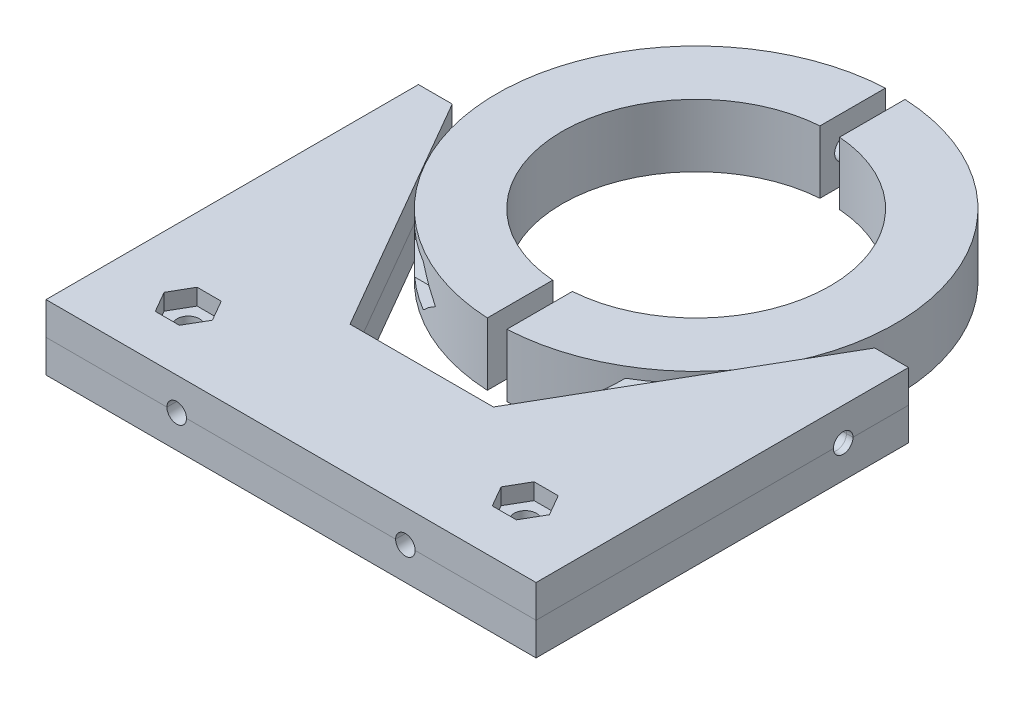
from build123d import *

# Parameters (mm, degrees)
SKETCH_3_W                       = 10
SKETCH_3_H                       = 9.6
CUT_EXTRUDE_1_DEPTH              = 44.399769585
CUT_EXTRUDE_1_DEPTH_BACK         = 44.399769585
SKETCH_5_W                       = 32
SKETCH_5_H                       = 100
HOLE_WIZARD_3_5_3_5_1_D          = 3.5
CUT_EXTRUDE_5_DEPTH              = 23
EXTRUDE_1_DEPTH                  = 5
SKETCH_14_R                      = 1.5
SKETCH_14_3_R                    = 1.5
HOLE_WIZARD_3_4_3_4_1_AT_2_COUNT = 2
HOLE_WIZARD_3_4_3_4_1_AT_2_PITCH = 51.570523521
CUT_EXTRUDE_4_DEPTH              = 2.5


with BuildPart() as part:
    # 掃出1: sweep along a path in 草圖2
    with BuildLine(Plane(origin=(0, 0, 0), x_dir=(1, 0, 0), z_dir=(0, 1, 0))) as sweep_1_path:
        CenterArc((0, 0), 20.5, 0, 360)
    # 草圖3 → 掃出1 (sweep)
    with BuildSketch(Plane(origin=(0, 0, 0), x_dir=(0, 0, -1), z_dir=(1, 0, 0))):
        with Locations((25.5, 0)):
            Rectangle(SKETCH_3_W, SKETCH_3_H)
    sweep(path=sweep_1_path.line)

    # 草圖5 → 除料-伸長1 (cut, two sides: drawn at the far end of the back side and taken through both)
    with BuildSketch(Plane(origin=(0, 0, 0), x_dir=(1, 0, 0), z_dir=(0, 1, 0)).offset(-CUT_EXTRUDE_1_DEPTH_BACK)):
        with Locations((-14.5, 0)):
            Rectangle(SKETCH_5_W, SKETCH_5_H)
    extrude(amount=CUT_EXTRUDE_1_DEPTH + CUT_EXTRUDE_1_DEPTH_BACK, mode=Mode.SUBTRACT)

    # Ø3.5 (3.5) 直徑孔1 (through all)
    with Locations(Plane(origin=(30.5, 0, 0), x_dir=(0, 0, -1), z_dir=(1, 0, 0))):
        with Locations((-24.4450483, 0), (24.4450483, 0)):
            Hole(HOLE_WIZARD_3_5_3_5_1_D / 2)

    # 草圖6 → 除料-伸長5 (cut)
    with BuildSketch(Plane(origin=(30.5, 0, 0), x_dir=(0, 0, -1), z_dir=(1, 0, 0))):
        Polygon((28.140090023, 0), (26.292569162, 3.2), (22.597527439, 3.2), (20.750006577, 0), (22.597527439, -3.2), (26.292569162, -3.2), align=None)
        Polygon((-20.750006577, 0), (-22.597527439, 3.2), (-26.292569162, 3.2), (-28.140090023, 0), (-26.292569162, -3.2), (-22.597527439, -3.2), align=None)
    extrude(amount=-CUT_EXTRUDE_5_DEPTH, mode=Mode.SUBTRACT)


with BuildPart() as body_2:
    # 鏡射8: mirrored copy
    add(part.part.mirror(Plane(origin=(0, 0, 0), x_dir=(0, 0, 1), z_dir=(1, 0, 0))))


with BuildPart() as body_3:
    # 草圖12 → 填料-伸長1 (new body)
    with BuildSketch(Plane(origin=(0, 0, 0), x_dir=(1, 0, 0), z_dir=(0, 1, 0))):
        Polygon((-32.331615075, -5), (-10.969655115, -42), (10.969655115, -42), (32.331615075, -5), (37.5, -5), (37.5, -62), (-37.5, -62), (-37.5, -5), align=None)
    extrude(amount=-EXTRUDE_1_DEPTH)

    # 除料-掃出2: sweep along a path in 草圖17
    with BuildLine(Plane(origin=(0, -5, 0), x_dir=(-1, 0, 0), z_dir=(0, -1, 0))) as sweep_2_path:
        Line((37.5, -15), (36.5, -15))
        ThreePointArc((36.5, -15), (34.378679656, -15.878679656), (33.5, -18))
        Line((33.5, -18), (33.5, -55.5))
        ThreePointArc((33.5, -55.5), (32.621320344, -57.621320344), (30.5, -58.5))
        Line((30.5, -58.5), (0, -58.5))
        Line((0, -58.5), (0, -42))
    # 草圖14 → 除料-掃出2 (sweep, cut)
    with BuildSketch(Plane.XY.offset(42)):
        Circle(SKETCH_14_R)
    sweep_2 = sweep(path=sweep_2_path.line, transition=Transition.RIGHT, mode=Mode.SUBTRACT)

    # 除料-掃出3: sweep along a path in 草圖18
    with BuildLine(Plane(origin=(0, -5, 0), x_dir=(-1, 0, 0), z_dir=(0, -1, 0))) as sweep_3_path:
        Line((0, -42), (0, -58.5))
        Line((0, -58.5), (17.5, -58.5))
        Line((17.5, -58.5), (17.5, -62))
    # 草圖14<3> → 除料-掃出3 (sweep, cut)
    with BuildSketch(Plane.XY.offset(42)):
        Circle(SKETCH_14_3_R)
    sweep_3 = sweep(path=sweep_3_path.line, transition=Transition.RIGHT, mode=Mode.SUBTRACT)

    # 鏡射2: 除料-掃出2, 除料-掃出3 across plane
    add(sweep_2.mirror(Plane(origin=(0, 0, 0), x_dir=(0, 0, 1), z_dir=(1, 0, 0))), mode=Mode.SUBTRACT)
    add(sweep_3.mirror(Plane(origin=(0, 0, 0), x_dir=(0, 0, 1), z_dir=(1, 0, 0))), mode=Mode.SUBTRACT)

    # 草圖21 → Ø3.4 (3.4) 直徑孔1 (revolve, cut)
    with BuildSketch(Plane(origin=(25.841816277, 0, 52), x_dir=(0, 0, 1), z_dir=(1, 0, 0))):
        Polygon((0, 0), (0, 11.021463052), (1.7, 10), (1.7, 0), align=None)
    hole_wizard_3_4_3_4_1 = revolve(axis=Axis((25.841816277, 6.35, 52), (0, -1, 0)), mode=Mode.SUBTRACT)

    # Ø3.4 (3.4) 直徑孔1 at 2: Ø3.4 (3.4) 直徑孔1 ×2
    with Locations(*[(-i * HOLE_WIZARD_3_4_3_4_1_AT_2_PITCH, 0, 0) for i in range(1, HOLE_WIZARD_3_4_3_4_1_AT_2_COUNT)]):
        add(hole_wizard_3_4_3_4_1, mode=Mode.SUBTRACT)

    # 草圖19 → 除料-伸長4 (cut)
    with BuildSketch(Plane(origin=(0, -5, 0), x_dir=(-1, 0, 0), z_dir=(0, 1, 0))):
        Polygon((23.881186383, 55.2), (22.033665521, 52), (23.881186383, 48.8), (27.576228105, 48.8), (29.423748967, 52), (27.576228105, 55.2), align=None)
        Polygon((-27.689337138, 55.2), (-29.536858, 52), (-27.689337138, 48.8), (-23.994295415, 48.8), (-22.146774554, 52), (-23.994295415, 55.2), align=None)
    extrude(amount=CUT_EXTRUDE_4_DEPTH, mode=Mode.SUBTRACT)


with BuildPart() as body_4:
    # 鏡射9: mirrored copy
    add(body_3.part.mirror(Plane.ZX))


solid = Compound([part.part, body_2.part, body_3.part, body_4.part])
